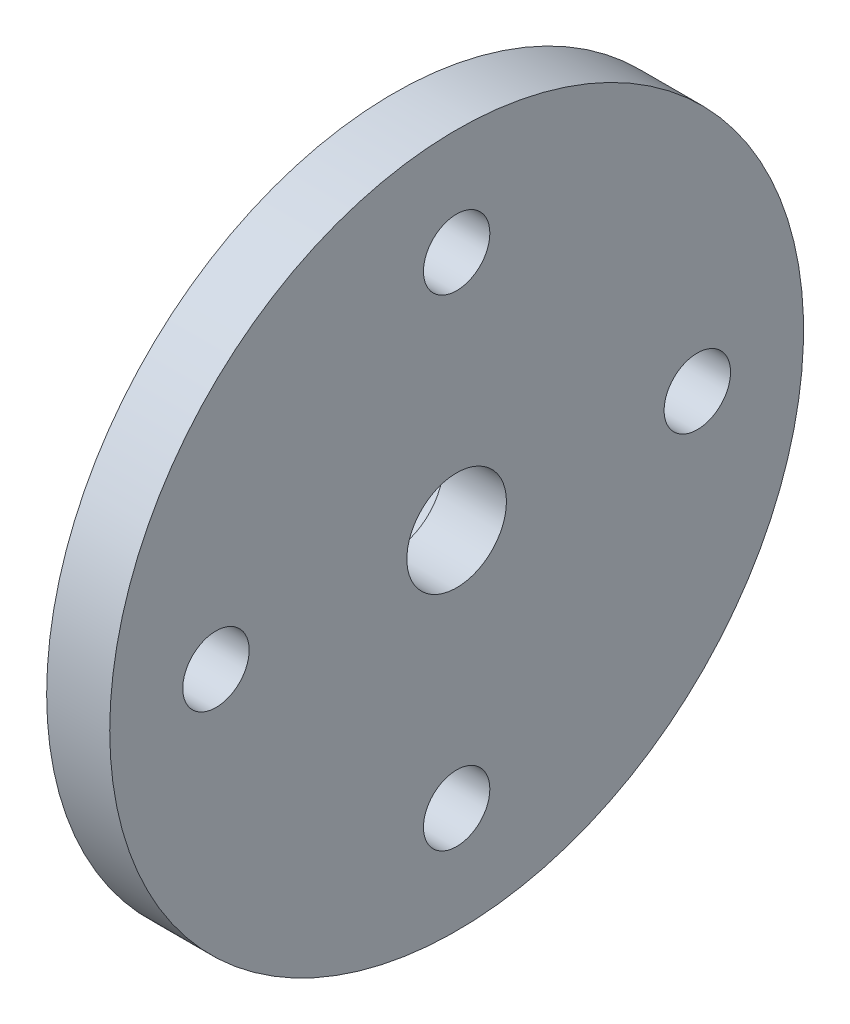
from build123d import *

# Parameters (mm, degrees)
SKETCH1_R           = 4.4
SKETCH1_R_2         = 3
BOSS_EXTRUDE1_DEPTH = 3.5
SKETCH2_R           = 10.45
BOSS_EXTRUDE2_DEPTH = 1.9
SKETCH3_R           = 1.5
CUT_EXTRUDE1_DEPTH  = 1.9
SKETCH4_R           = 1
CUT_EXTRUDE2_DEPTH  = 5.4


with BuildPart() as part:
    # Sketch1 → Boss-Extrude1 (new body)
    with BuildSketch(Plane(origin=(0, 0, 0), x_dir=(0, 0, -1), z_dir=(1, 0, 0))):
        Circle(SKETCH1_R)
        Circle(SKETCH1_R_2, mode=Mode.SUBTRACT)
    extrude(amount=BOSS_EXTRUDE1_DEPTH)

    # Sketch2 → Boss-Extrude2 (add)
    with BuildSketch(Plane(origin=(3.5, 0, 0), x_dir=(0, 0, -1), z_dir=(1, 0, 0))):
        with Locations(Location((0, 0, 0), (0, 0, 180))):
            Circle(SKETCH2_R)
    extrude(amount=BOSS_EXTRUDE2_DEPTH)

    # Sketch3 → Cut-Extrude1 (cut)
    with BuildSketch(Plane(origin=(5.4, 0, 0), x_dir=(0, 0, -1), z_dir=(1, 0, 0))):
        Circle(SKETCH3_R)
    extrude(amount=-CUT_EXTRUDE1_DEPTH, mode=Mode.SUBTRACT)

    # Sketch4 → Cut-Extrude2 (cut)
    with BuildSketch(Plane(origin=(5.4, 0, 0), x_dir=(0, 0, -1), z_dir=(1, 0, 0))):
        with Locations((0, 7.25)):
            Circle(SKETCH4_R)
        with Locations((7.25, 0)):
            Circle(SKETCH4_R)
        with Locations((0, -7.25)):
            Circle(SKETCH4_R)
        with Locations((-7.25, 0)):
            Circle(SKETCH4_R)
    extrude(amount=-CUT_EXTRUDE2_DEPTH, mode=Mode.SUBTRACT)


solid = part.part
